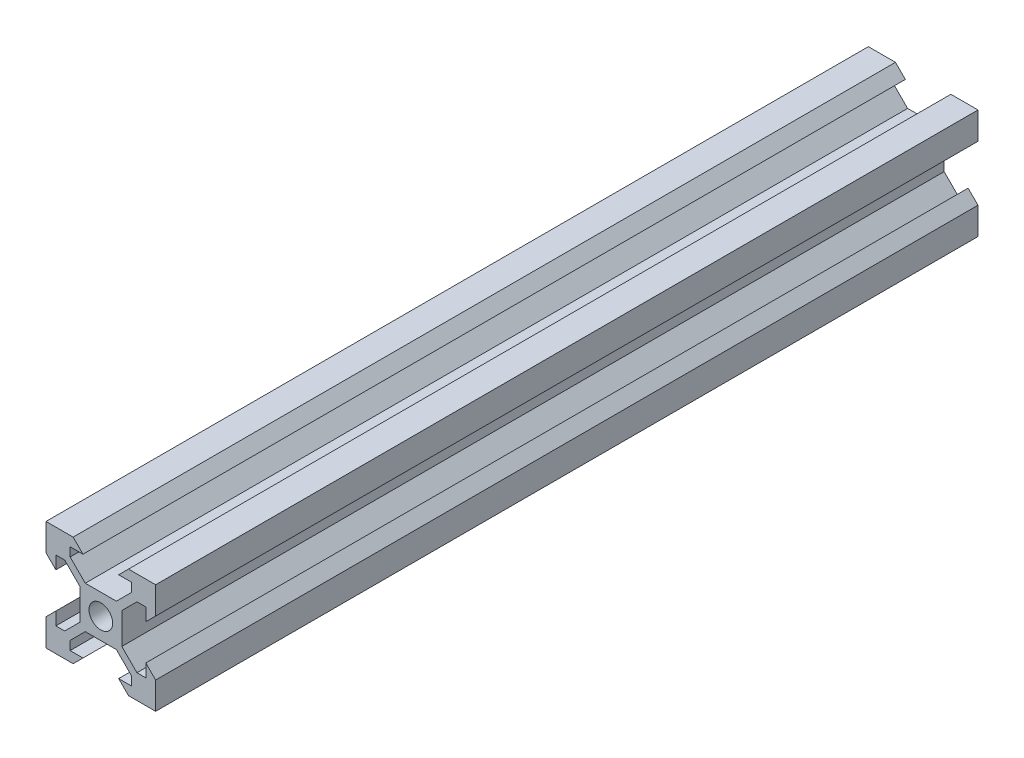
from build123d import *

# Parameters (mm, degrees)
CROQUIS1_R      = 2.15
BOSCHBASE_DEPTH = 150


with BuildPart() as part:
    # Croquis1 → BoschBase (new body)
    with BuildSketch(Plane.XY):
        Polygon((4.4, 0), (0, 0), (0, -0.56736664), (0, -4.4), (0, -4.95), (1.8, -6.75), (1.8, -4.4), (3.410050506, -4.4), (6.175, -7.164949494), (6.175, -12.835050506), (3.410050506, -15.6), (1.8, -15.6), (1.8, -13.25), (0, -15.05), (0, -15.6), (0, -20), (4.4, -20), (4.95, -20), (6.75, -18.2), (4.4, -18.2), (4.4, -16.589949494), (7.164949494, -13.825), (12.835050506, -13.825), (15.6, -16.589949494), (15.6, -18.2), (13.25, -18.2), (15.05, -20), (15.6, -20), (18.2, -20), (20, -20), (20, -15.6), (20, -15.05), (18.2, -13.25), (18.2, -15.6), (16.589949494, -15.6), (13.825, -12.835050506), (13.825, -7.164949494), (16.589949494, -4.4), (18.2, -4.4), (18.2, -6.75), (20, -4.95), (20, -4.4), (20, 0), (15.6, 0), (15.05, 0), (13.25, -1.8), (15.6, -1.8), (15.6, -3.410050506), (12.835050506, -6.175), (7.164949494, -6.175), (4.4, -3.410050506), (4.4, -1.8), (6.75, -1.8), (4.95, 0), align=None)
        with Locations((10, -10)):
            Circle(CROQUIS1_R, mode=Mode.SUBTRACT)
    extrude(amount=BOSCHBASE_DEPTH)


solid = part.part
